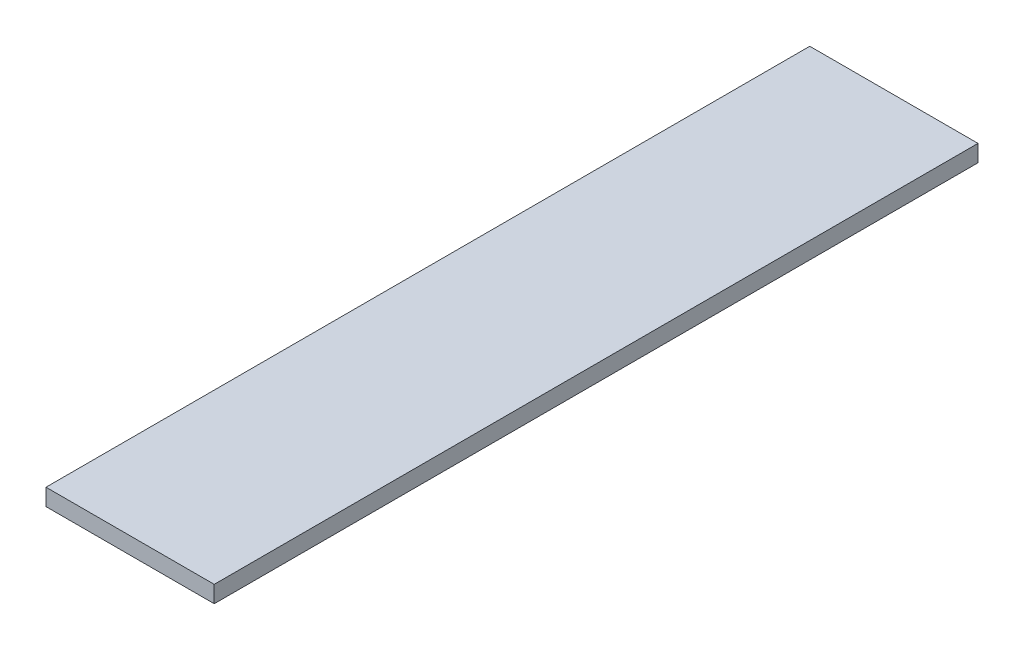
from build123d import *

# Parameters (mm, degrees)
SKETCH1_W           = 63.5
SKETCH1_H           = 6.35
BOSS_EXTRUDE1_DEPTH = 288.29


with BuildPart() as part:
    # Sketch1 → Boss-Extrude1 (new body)
    with BuildSketch(Plane.XY):
        with Locations((31.75, 3.175)):
            Rectangle(SKETCH1_W, SKETCH1_H)
    extrude(amount=BOSS_EXTRUDE1_DEPTH)


solid = part.part
